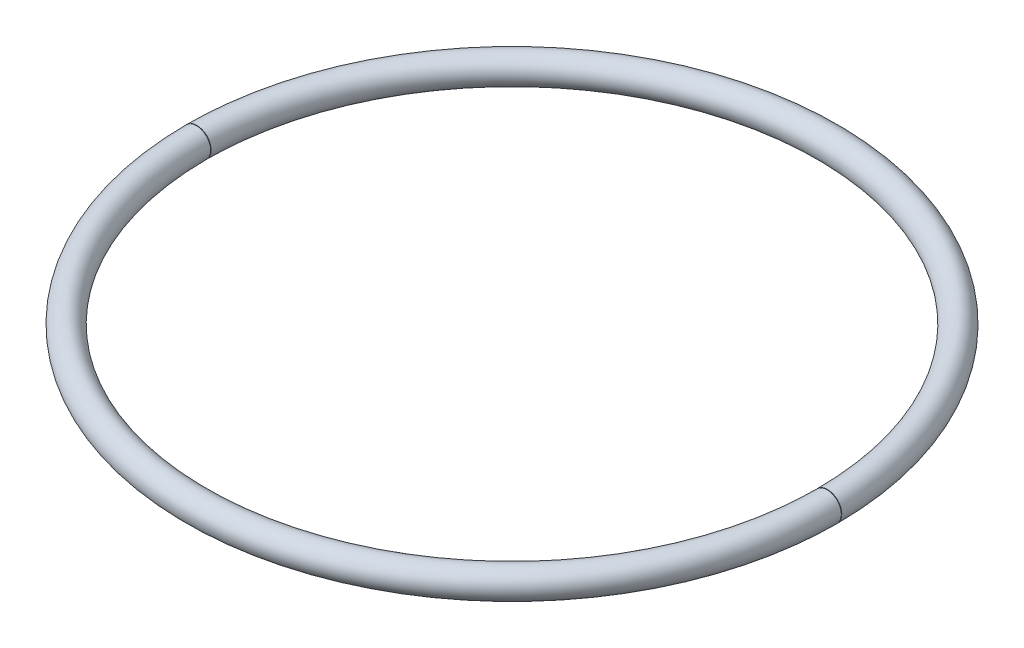
from build123d import *

# Parameters (mm, degrees)
SWEEP4_PROFILE_R        = 25.4
SHELL2_T                = -3.175
CUT_EXTRUDE1_DEPTH      = 834.305954049
CUT_EXTRUDE1_DEPTH_BACK = 834.305954049
SKETCH27_W              = 101.6
SKETCH27_H              = 0.757975352


with BuildPart() as part:
    # Sweep4: sweep along a path in Sketch26
    with BuildLine(Plane(origin=(0, 0, 0), x_dir=(1, 0, 0), z_dir=(0, 1, 0))) as sweep4_path:
        ThreePointArc((563.562360255, 0.396875), (-563.5625, 0), (563.562360255, -0.396875))
    # Sweep4 profile (on start of the path) → Sweep4 (sweep)
    with BuildSketch(Plane(origin=(563.562360255, 0, -0.396875), x_dir=(-0.9999997520332959, 0, 0.0007042253521126144), z_dir=(-0.0007042253521126144, 0, -0.9999997520332959))):
        Circle(SWEEP4_PROFILE_R)
    sweep(path=sweep4_path.line)

    # Shell2
    shell2_openings = [part.faces().sort_by_distance(p)[0] for p in [
        (563.562360255, 0, 0.396875),
        (563.562360255, 0, -0.396875),
    ]]
    offset(amount=SHELL2_T, openings=shell2_openings, kind=Kind.INTERSECTION)

    # Sketch27 → Cut-Extrude1 (cut, two sides: drawn at the far end of the back side and taken through both)
    with BuildSketch(Plane(origin=(0, 0, 0), x_dir=(1, 0, 0), z_dir=(0, 1, 0)).offset(-CUT_EXTRUDE1_DEPTH_BACK)):
        with Locations((-558.8, 0)):
            Rectangle(SKETCH27_W, SKETCH27_H)
    extrude(amount=CUT_EXTRUDE1_DEPTH + CUT_EXTRUDE1_DEPTH_BACK, mode=Mode.SUBTRACT)


with BuildPart() as cut_extrude1_piece_1:
    # of the separate pieces the step leaves, piece 1, a body of its own (cut_extrude1_pieces)
    add(part.part.solids().sort_by_distance((-538.162366554, 0, 0.378987676))[0])


with BuildPart() as cut_extrude1_piece_2:
    # of the separate pieces the step leaves, piece 2, a body of its own (cut_extrude1_pieces)
    add(part.part.solids().sort_by_distance((538.162366554, 0, -0.378987676))[0])


solid = Compound([cut_extrude1_piece_1.part, cut_extrude1_piece_2.part])
